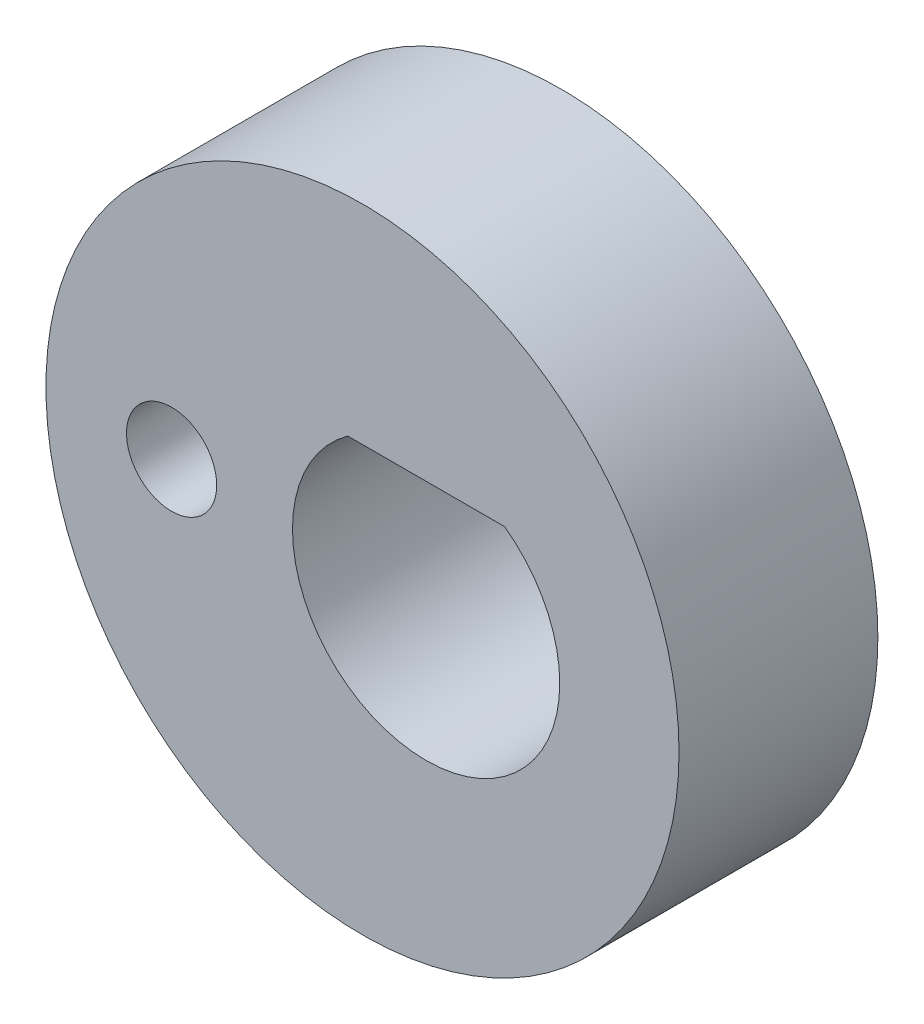
from build123d import *

# Parameters (mm, degrees)
SKETCH1_R           = 6.31825
BOSS_EXTRUDE1_DEPTH = 3.96875
SKETCH8_R           = 0.9
CUT_EXTRUDE2_DEPTH  = 11.642029773


with BuildPart() as part:
    # Sketch1 → Boss-Extrude1 (new body)
    with BuildSketch(Plane.XY):
        with Locations((-1.27, 0)):
            Circle(SKETCH1_R)
        with BuildLine():
            Line((-1.565761157, 2.159), (1.565761157, 2.159))
            ThreePointArc((1.565761157, 2.159), (0, -2.667), (-1.565761157, 2.159))
        make_face(mode=Mode.SUBTRACT)
    extrude(amount=BOSS_EXTRUDE1_DEPTH)

    # Sketch8 → Cut-Extrude2 (cut, through all)
    with BuildSketch(Plane.XY.offset(3.96875)):
        with Locations((-5.08, 0)):
            Circle(SKETCH8_R)
    extrude(amount=-CUT_EXTRUDE2_DEPTH, mode=Mode.SUBTRACT)


solid = part.part
